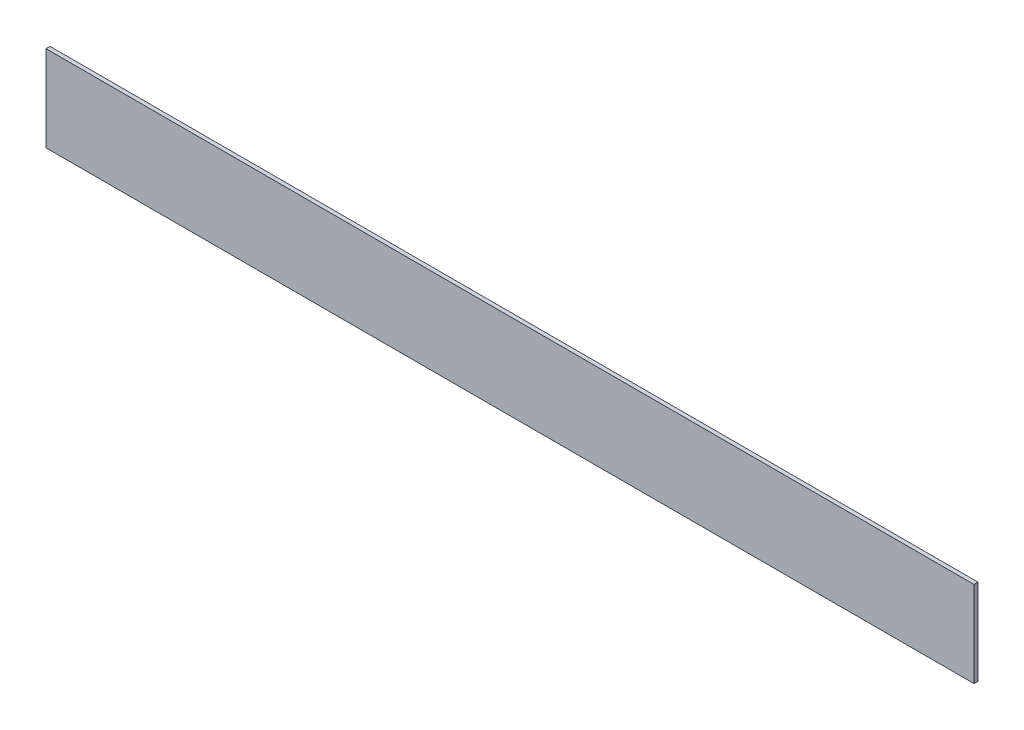
from build123d import *

# Parameters (mm, degrees)
SKETCH_1_W      = 1396
SKETCH_1_H      = 129.22
EXTRUDE_1_DEPTH = 6


with BuildPart() as part:
    # Эскиз1 → Бобышка-Вытянуть1 (new body)
    with BuildSketch(Plane.XY):
        with Locations((-251, -371.69)):
            Rectangle(SKETCH_1_W, SKETCH_1_H)
    extrude(amount=-EXTRUDE_1_DEPTH)


solid = part.part
